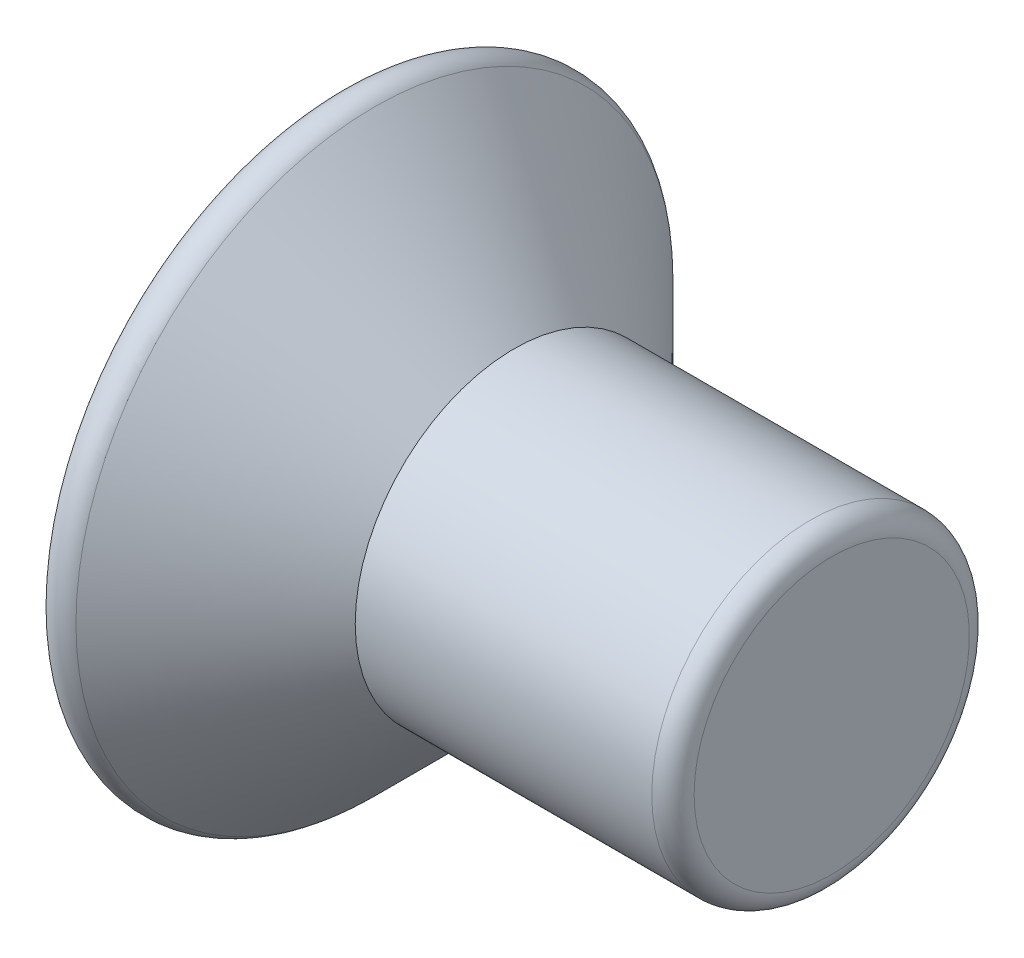
from build123d import *

# Parameters (mm, degrees)
ENL_V_MAT_EXTRU_1_DEPTH = 0.1
CONG_1_R                = 0.2


with BuildPart() as part:
    # Esquisse1 → Révolution1 (revolve)
    with BuildSketch(Plane.XY, mode=Mode.PRIVATE) as r_volution1_sk:
        Polygon((0, 0), (0, 3.16), (1.66, 1.5), (4.66, 1.5), (4.66, 0), align=None)
    revolve(r_volution1_sk.sketch.rotate(Axis((-5.768945874, 0, 0), (1, 0, 0)), 90), axis=Axis((-5.768945874, 0, 0), (1, 0, 0)))

    # Esquisse2 → Enlèv. mat.-Extru.1 (cut)
    with BuildSketch(Plane.ZY):
        Polygon((0, -1.1), (0.952627944, -0.55), (0.952627944, 0.55), (0, 1.1), (-0.952627944, 0.55), (-0.952627944, -0.55), align=None)
    extrude(amount=-ENL_V_MAT_EXTRU_1_DEPTH, mode=Mode.SUBTRACT)

    # Congé1
    cong_1_edges = [part.edges().sort_by_distance(p)[0] for p in [
        (4.66, 0, -1.5),
        (0, 0, -3.16),
    ]]
    fillet(cong_1_edges, radius=CONG_1_R)


solid = part.part
